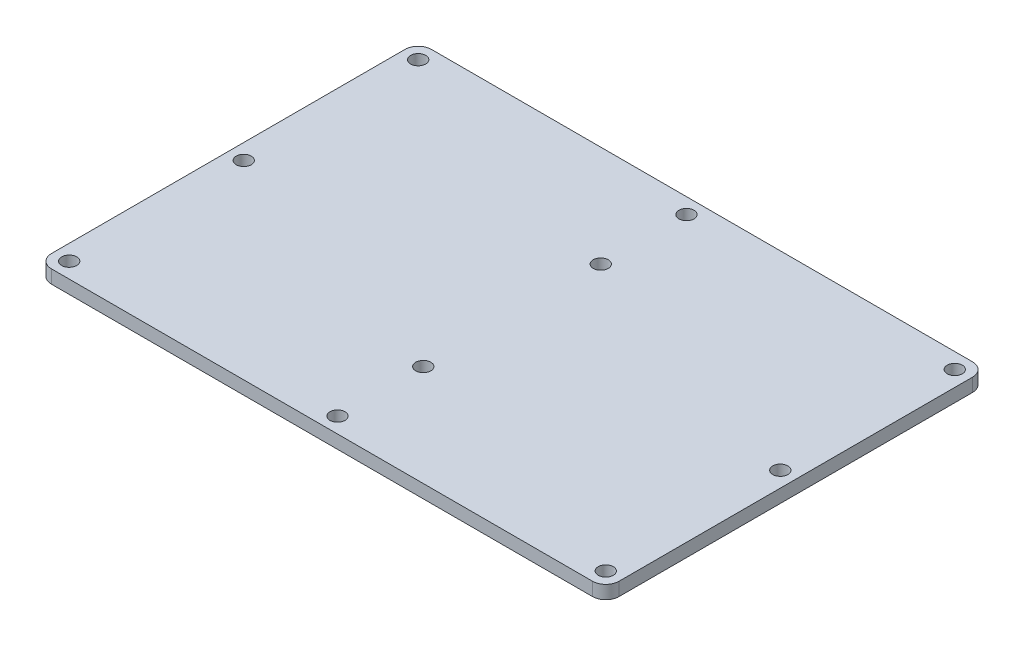
from build123d import *

# Parameters (mm, degrees)
SKETCH1_W            = 128
SKETCH1_H            = 85.7
BOSS_EXTRUDE1_DEPTH  = 3
M3_CLEARANCE_HOLE1_D = 3.4
FILLET1_R            = 3


with BuildPart() as part:
    # Sketch1 → Boss-Extrude1 (new body)
    with BuildSketch(Plane(origin=(0, 0, 0), x_dir=(1, 0, 0), z_dir=(0, 1, 0))):
        Rectangle(SKETCH1_W, SKETCH1_H)
    extrude(amount=BOSS_EXTRUDE1_DEPTH)

    # M3 Clearance Hole1 (through all)
    with Locations(Plane(origin=(0, 3, 0), x_dir=(1, 0, 0), z_dir=(0, 1, 0))):
        with Locations((-60.5, 39.35), (0, 39.35), (60.5, 39.35), (60.5, 0), (60.5, -39.35), (0, -39.35), (-60.5, -39.35), (-60.5, 0), (0, -20.01), (0, 20.01)):
            Hole(M3_CLEARANCE_HOLE1_D / 2)

    # Fillet1
    fillet1_edges = [part.edges().sort_by_distance(p)[0] for p in [
        (64, 1.5, 42.85),
        (-64, 1.5, 42.85),
        (-64, 1.5, -42.85),
        (64, 1.5, -42.85),
    ]]
    fillet(fillet1_edges, radius=FILLET1_R)


solid = part.part
